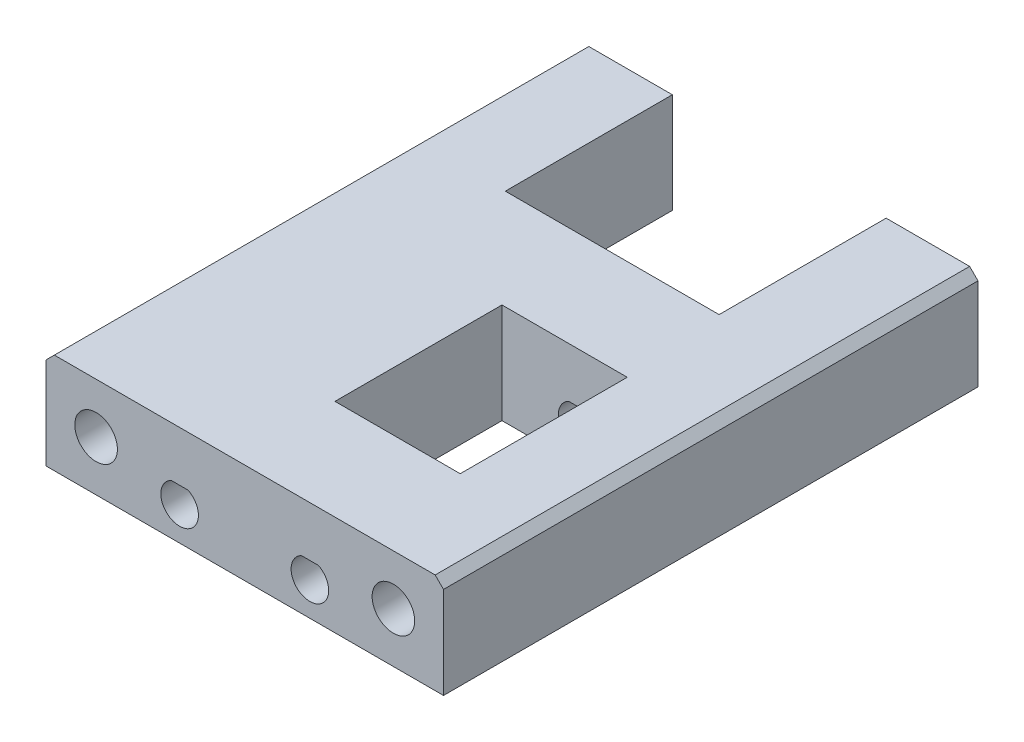
from build123d import *
from OCP.BRepFilletAPI import BRepFilletAPI_MakeChamfer

# Parameters (mm, degrees)
BOSS_EXTRUDE1_DEPTH = 44
SKETCH2_R           = 2.25
CUT_EXTRUDE1_DEPTH  = 66.098079849
BOSS_EXTRUDE2_START = 20
BOSS_EXTRUDE2_DEPTH = 20
BOSS_EXTRUDE3_START = -64
BOSS_EXTRUDE3_DEPTH = 64
SKETCH6_W           = 25.6
SKETCH6_H           = 20
CUT_EXTRUDE2_DEPTH  = 66.098079849
CHAMFER1_SIZE       = 10
CHAMFER1_SIZE2      = 0.874886635
CHAMFER2_SIZE       = 1
SKETCH7_W           = 15
SKETCH7_H           = 20
CUT_EXTRUDE3_DEPTH  = 66.922378598


with BuildPart() as part:
    # Sketch1 → Boss-Extrude1 (new body)
    with BuildSketch(Plane.XY):
        with BuildLine():
            Line((0, 0), (47.6, 0))
            Line((47.6, 0), (47.6, 6))
            Line((47.6, 6), (44.15, 6))
            ThreePointArc((44.15, 6), (41.6, 3.45), (39.05, 6))
            Line((39.05, 6), (8.55, 6))
            ThreePointArc((8.55, 6), (6, 3.45), (3.45, 6))
            Line((3.45, 6), (0, 6))
            Line((0, 6), (0, 0))
        make_face()
    extrude(amount=BOSS_EXTRUDE1_DEPTH)

    # Sketch2 → Cut-Extrude1 (cut, through all)
    with BuildSketch(Plane.XY.offset(44)):
        with Locations((16, 4)):
            Circle(SKETCH2_R)
        with Locations((31.6, 4)):
            Circle(SKETCH2_R)
    extrude(amount=-CUT_EXTRUDE1_DEPTH, mode=Mode.SUBTRACT)

    # Sketch4 → Boss-Extrude2 (add)
    with BuildSketch(Plane(origin=(0, 0, 0), x_dir=(-1, 0, 0), z_dir=(0, 0, -1)).offset(BOSS_EXTRUDE2_START)):
        with BuildLine():
            Line((-11, 6), (-11, 0))
            Line((-11, 0), (0, 0))
            Line((0, 0), (0, 6))
            Line((0, 6), (-3.45, 6))
            ThreePointArc((-3.45, 6), (-6, 3.45), (-8.55, 6))
            Line((-8.55, 6), (-11, 6))
        make_face()
        with BuildLine():
            Line((-36.6, 6), (-36.6, 0))
            Line((-36.6, 0), (-47.6, 0))
            Line((-47.6, 0), (-47.6, 6))
            Line((-47.6, 6), (-44.15, 6))
            ThreePointArc((-44.15, 6), (-41.6, 3.45), (-39.05, 6))
            Line((-39.05, 6), (-36.6, 6))
        make_face()
    extrude(amount=-BOSS_EXTRUDE2_DEPTH)

    # Sketch5 → Boss-Extrude3 (add)
    with BuildSketch(Plane.XY.offset(44).offset(BOSS_EXTRUDE3_START)):
        with BuildLine():
            Line((0, 6), (0, 12))
            Line((0, 12), (47.6, 12))
            Line((47.6, 12), (47.6, 6))
            Line((47.6, 6), (44.15, 6))
            ThreePointArc((44.15, 6), (41.6, 8.55), (39.05, 6))
            Line((39.05, 6), (8.55, 6))
            ThreePointArc((8.55, 6), (6, 8.55), (3.45, 6))
            Line((3.45, 6), (0, 6))
        make_face()
    extrude(amount=BOSS_EXTRUDE3_DEPTH)

    # Sketch6 → Cut-Extrude2 (cut, through all)
    with BuildSketch(Plane.XZ.offset(-6)):
        with Locations((23.8, -10)):
            Rectangle(SKETCH6_W, SKETCH6_H)
    extrude(amount=-CUT_EXTRUDE2_DEPTH, mode=Mode.SUBTRACT)

    # Chamfer1: one chamfer whose edges measure the first distance from different faces: ONE call of the kernel's chamfer builder (chamfer() names one face for all edges)
    chamfer1_edges_1 = [part.edges().sort_by_distance(p)[0] for p in [
        (6, 3.45, -20),
    ]]
    chamfer1_side_1 = [part.faces().sort_by_distance(p)[0] for p in [
        (6, 3.45, 12),
    ]]
    chamfer1_edges_2 = [part.edges().sort_by_distance(p)[0] for p in [
        (41.6, 8.55, -20),
    ]]
    chamfer1_side_2 = [part.faces().sort_by_distance(p)[0] for p in [
        (41.6, 8.55, 12),
    ]]
    chamfer1 = BRepFilletAPI_MakeChamfer(part.part.solid().wrapped)
    for e in chamfer1_edges_1:
        chamfer1.Add(CHAMFER1_SIZE, CHAMFER1_SIZE2, e.wrapped, chamfer1_side_1[0].wrapped)  # the first distance lies on this face
    for e in chamfer1_edges_2:
        chamfer1.Add(CHAMFER1_SIZE, CHAMFER1_SIZE2, e.wrapped, chamfer1_side_2[0].wrapped)  # the first distance lies on this face
    add(Compound.cast(chamfer1.Shape()), mode=Mode.REPLACE)

    # Chamfer2
    chamfer2_edges = [part.edges().sort_by_distance(p)[0] for p in [
        (47.6, 12, 12),
        (0, 12, 12),
    ]]
    chamfer(chamfer2_edges, length=CHAMFER2_SIZE)

    # Sketch7 → Cut-Extrude3 (cut, through all)
    with BuildSketch(Plane.XZ):
        with Locations((30.1, 22)):
            Rectangle(SKETCH7_W, SKETCH7_H)
    extrude(amount=-CUT_EXTRUDE3_DEPTH, mode=Mode.SUBTRACT)


solid = part.part
